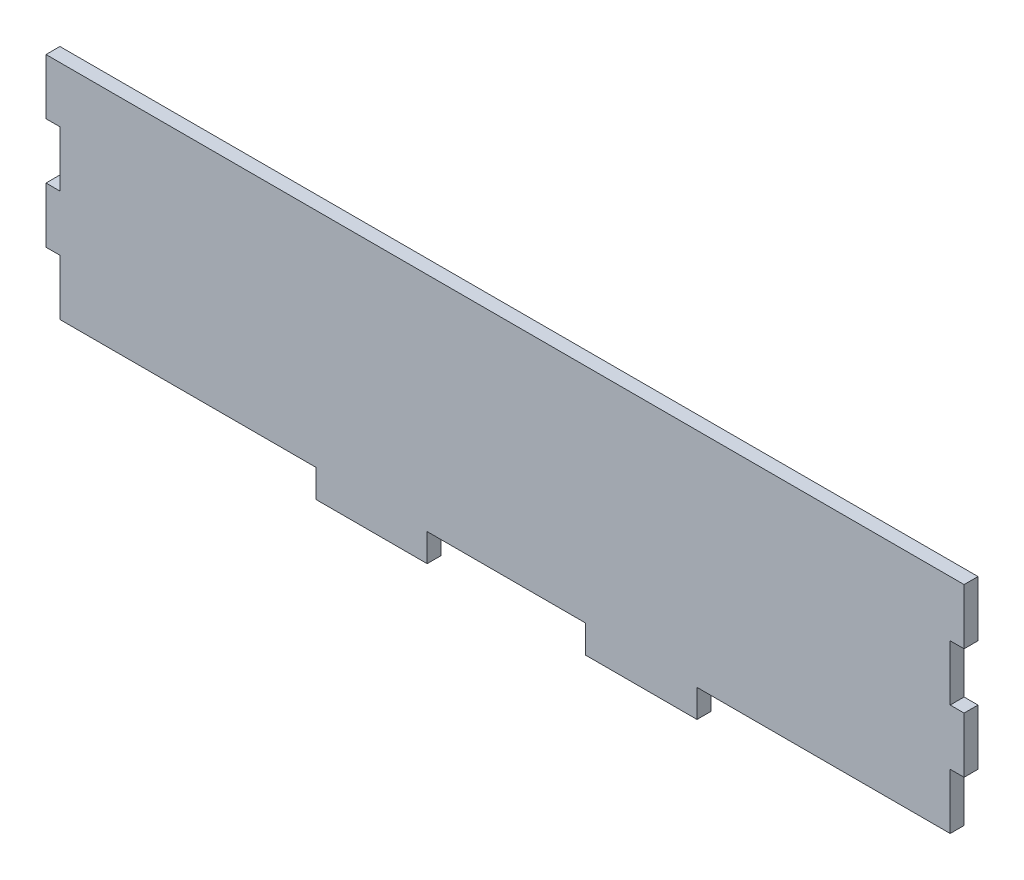
from build123d import *

# Parameters (mm, degrees)
SKETCH1_W           = 203.2
SKETCH1_H           = 101.6
BOSS_EXTRUDE1_DEPTH = 3.175
SKETCH2_W           = 3.175
SKETCH2_H           = 12.7
SKETCH2_W_2         = 25.4
SKETCH2_H_2         = 6.35
BOSS_EXTRUDE2_DEPTH = 3.175
SKETCH3_W           = 25.4
SKETCH3_H           = 6.35
CUT_EXTRUDE1_DEPTH  = 120.947785411
SKETCH4_W           = 245.475029748
SKETCH4_H           = 66.468196642
CUT_EXTRUDE2_DEPTH  = 120.390132549


with BuildPart() as part:
    # Sketch1 → Boss-Extrude1 (new body)
    with BuildSketch(Plane.XY):
        Rectangle(SKETCH1_W, SKETCH1_H)
    extrude(amount=BOSS_EXTRUDE1_DEPTH)

    # Sketch2 → Boss-Extrude2 (add)
    with BuildSketch(Plane.XY.offset(3.175)):
        with Locations((-103.1875, 19.05)):
            Rectangle(SKETCH2_W, SKETCH2_H)
        with Locations((-103.1875, 44.45)):
            Rectangle(SKETCH2_W, SKETCH2_H)
        with Locations((-103.1875, -6.35)):
            Rectangle(SKETCH2_W, SKETCH2_H)
        with Locations((-103.1875, -31.75)):
            Rectangle(SKETCH2_W, SKETCH2_H)
        with Locations((-92.075, -53.975)):
            Rectangle(SKETCH2_W_2, SKETCH2_H_2)
        with Locations((-30.48, -53.975)):
            Rectangle(SKETCH2_W_2, SKETCH2_H_2)
        with Locations((31.115, -53.975)):
            Rectangle(SKETCH2_W_2, SKETCH2_H_2)
        with Locations((92.71, -53.975)):
            Rectangle(SKETCH2_W_2, SKETCH2_H_2)
        with Locations((103.1875, -31.75)):
            Rectangle(SKETCH2_W, SKETCH2_H)
        with Locations((103.1875, -6.35)):
            Rectangle(SKETCH2_W, SKETCH2_H)
        with Locations((103.1875, 19.05)):
            Rectangle(SKETCH2_W, SKETCH2_H)
        with Locations((103.1875, 44.45)):
            Rectangle(SKETCH2_W, SKETCH2_H)
    extrude(amount=-BOSS_EXTRUDE2_DEPTH)

    # Sketch3 → Cut-Extrude1 (cut, through all)
    with BuildSketch(Plane.XY.offset(3.175)):
        with Locations((-92.075, -53.975)):
            Rectangle(SKETCH3_W, SKETCH3_H)
        with Locations((92.71, -53.975)):
            Rectangle(SKETCH3_W, SKETCH3_H)
    extrude(amount=-CUT_EXTRUDE1_DEPTH, mode=Mode.SUBTRACT)

    # Sketch4 → Cut-Extrude2 (cut, through all)
    with BuildSketch(Plane.XY.offset(3.175)):
        with Locations((-8.102055055, 33.234098321)):
            Rectangle(SKETCH4_W, SKETCH4_H)
    extrude(amount=-CUT_EXTRUDE2_DEPTH, mode=Mode.SUBTRACT)


solid = part.part
